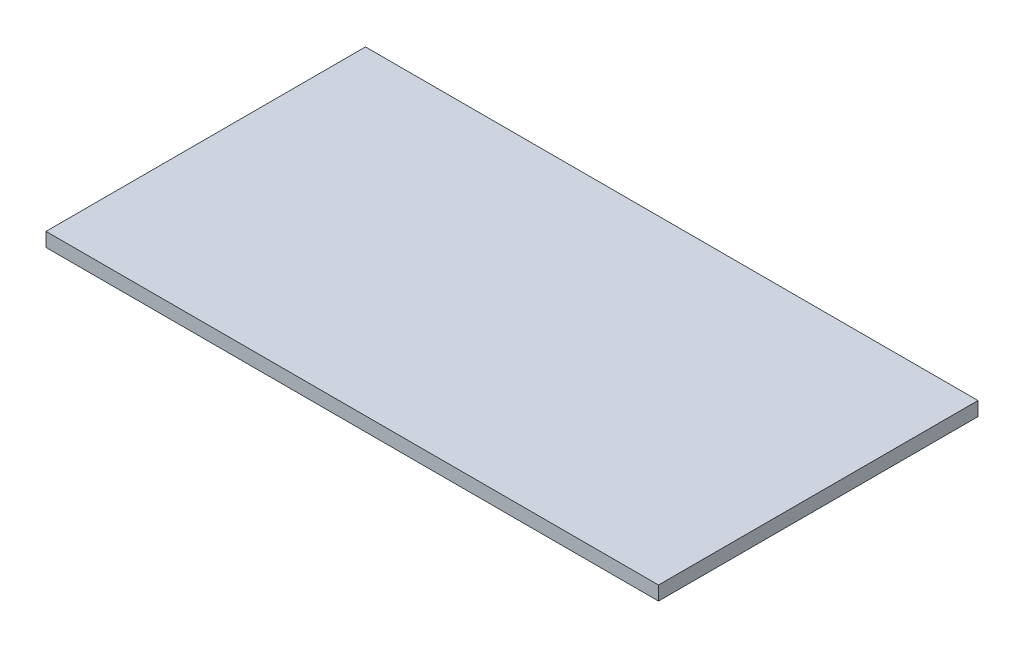
from build123d import *

# Parameters (mm, degrees)
SKETCH1_W           = 111.489354002
SKETCH1_H           = 58.153397612
BOSS_EXTRUDE1_DEPTH = 2.54


with BuildPart() as part:
    # Sketch1 → Boss-Extrude1 (new body)
    with BuildSketch(Plane(origin=(0, 0, 0), x_dir=(1, 0, 0), z_dir=(0, 1, 0))):
        Rectangle(SKETCH1_W, SKETCH1_H)
    extrude(amount=BOSS_EXTRUDE1_DEPTH)


solid = part.part
